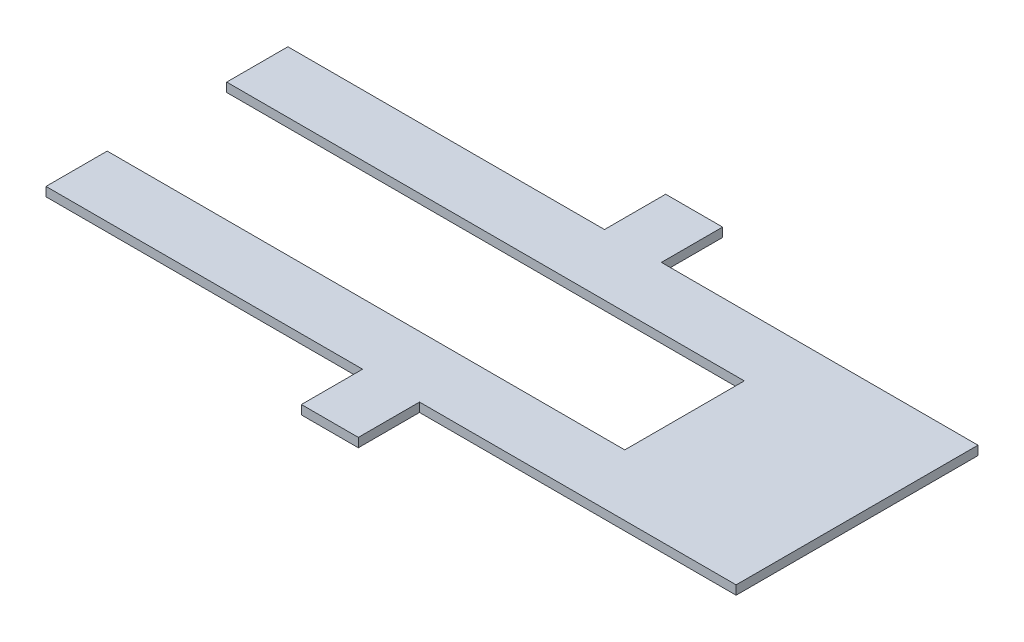
from build123d import *

# Parameters (mm, degrees)
BOSS_EXTRUDE1_DEPTH = 12.7


with BuildPart() as part:
    # Sketch1 → Boss-Extrude1 (new body)
    with BuildSketch(Plane(origin=(0, 0, 0), x_dir=(1, 0, 0), z_dir=(0, 1, 0))):
        Polygon((-485.191768636, 167.670757629), (-40.191768636, 167.670757629), (-40.191768636, 253.670757629), (39.808231364, 253.670757629), (39.808231364, 167.670757629), (484.808231364, 167.670757629), (484.808231364, -172.329242371), (39.808231364, -172.329242371), (39.808231364, -258.329242371), (-40.191768636, -258.329242371), (-40.191768636, -172.329242371), (-485.191768636, -172.329242371), (-485.191768636, -86.329242371), (242.308231364, -86.329242371), (242.308231364, 81.670757629), (-485.191768636, 81.670757629), align=None)
    extrude(amount=BOSS_EXTRUDE1_DEPTH)


solid = part.part
